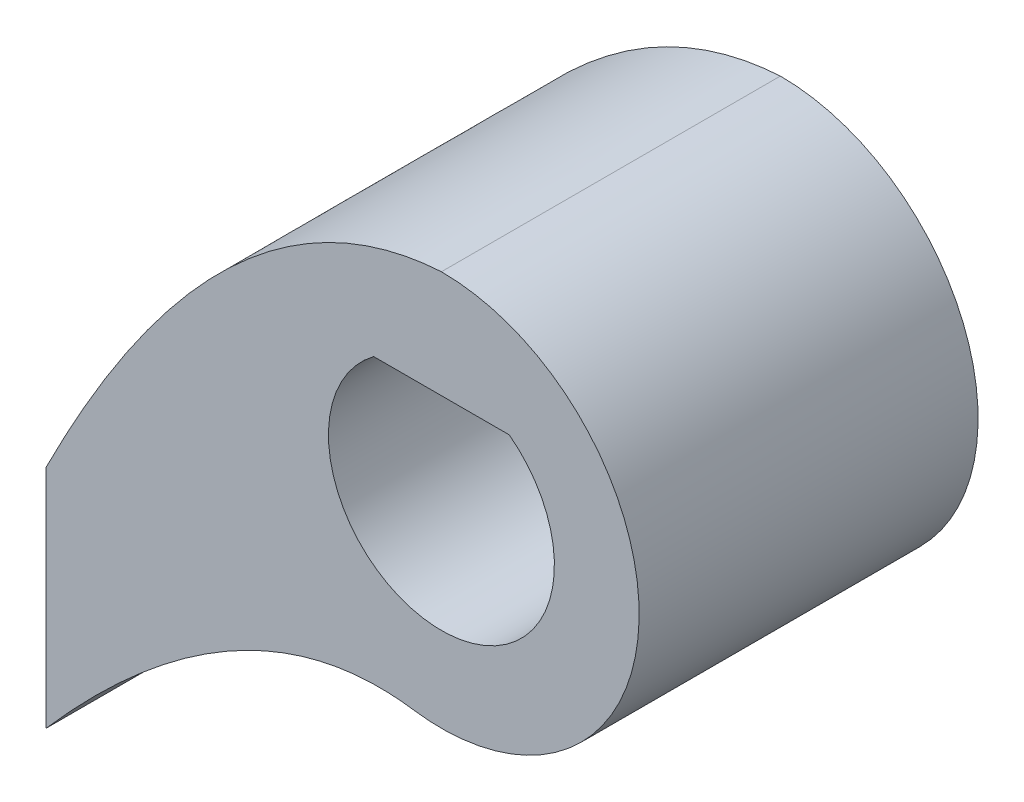
from build123d import *

# Parameters (mm, degrees)
AUFSATZ_LINEAR_AUSTRAGEN1_DEPTH = 6


with BuildPart() as part:
    # Skizze1 → Aufsatz-Linear austragen1 (new body)
    with BuildSketch(Plane.XY):
        with BuildLine():
            Line((-7, -7), (-7, -3))
            add(Edge.make_bspline(
                [(-7, -3), (-3.846414533, 3.271268296), (0, 3.5)],
                knots=[0, 0, 0, 0.663529029, 0.663529029, 0.663529029], degree=2))
            ThreePointArc((0, 3.5), (3.491013868, -0.250643519), (-0.5, -3.464101615))
            add(Edge.make_bspline(
                [(-7, -7), (-3.533418442, -3.026265377), (-0.5, -3.464101615)],
                knots=[0, 0, 0, 0.361848159, 0.361848159, 0.361848159], degree=2))
        make_face()
        with BuildLine():
            Line((1.2, 1.6), (-1.2, 1.6))
            ThreePointArc((-1.2, 1.6), (0, -2), (1.2, 1.6))
        make_face(mode=Mode.SUBTRACT)
    extrude(amount=AUFSATZ_LINEAR_AUSTRAGEN1_DEPTH)


solid = part.part
